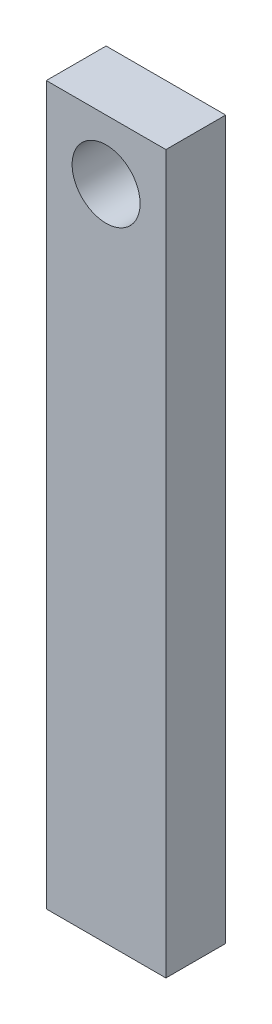
from build123d import *

# Parameters (mm, degrees)
SKETCH_1_R      = 14.438297444
EXTRUDE_1_DEPTH = 25.4


with BuildPart() as part:
    # 草图1 → 凸台-拉伸1 (new body)
    with BuildSketch(Plane.XY):
        Polygon((-59.598552365, 0), (-8.798552365, 0), (-8.798552365, 304.8), (-34.198552365, 304.8), (-59.598552365, 304.8), align=None)
        with Locations((-34.198552365, 279.4)):
            Circle(SKETCH_1_R, mode=Mode.SUBTRACT)
    extrude(amount=EXTRUDE_1_DEPTH)


solid = part.part
